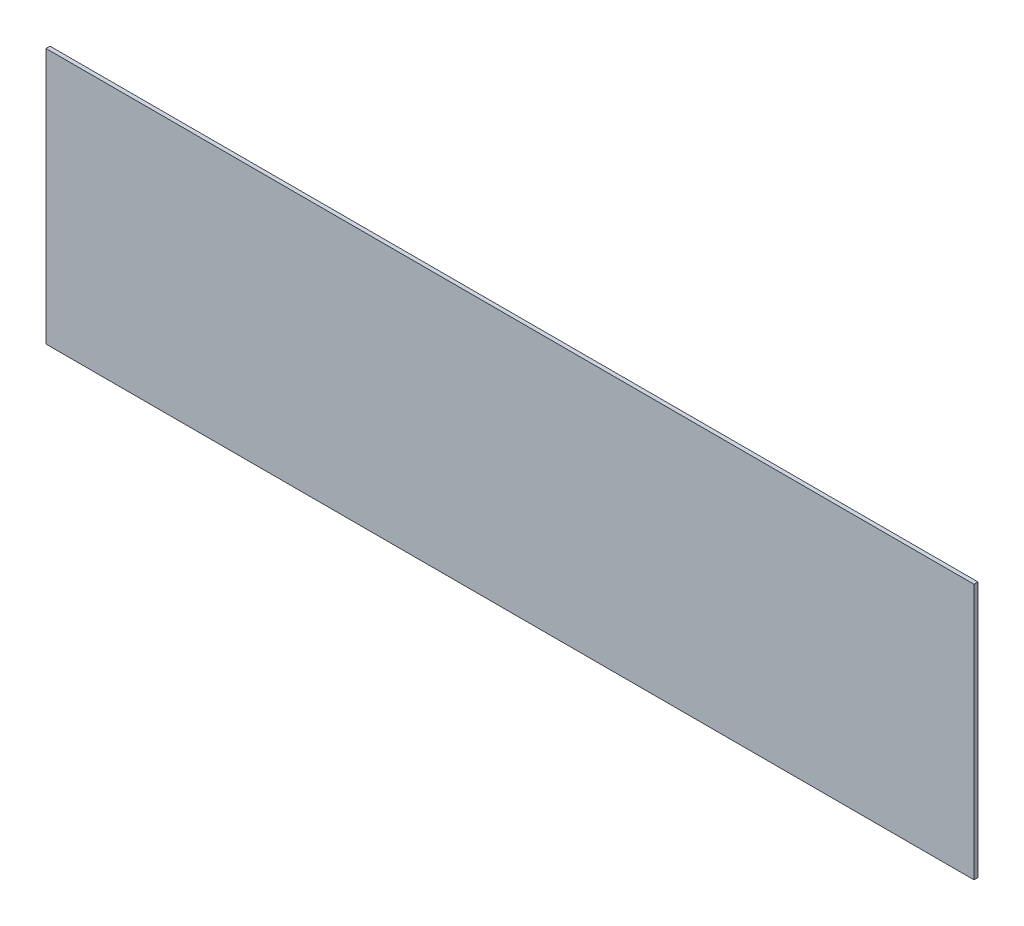
from build123d import *

# Parameters (mm, degrees)
SKETCH1_W           = 736.6
SKETCH1_H           = 203.2
BOSS_EXTRUDE1_DEPTH = 3.175


with BuildPart() as part:
    # Sketch1 → Boss-Extrude1 (new body)
    with BuildSketch(Plane.XY):
        Rectangle(SKETCH1_W, SKETCH1_H)
    extrude(amount=BOSS_EXTRUDE1_DEPTH)


solid = part.part
